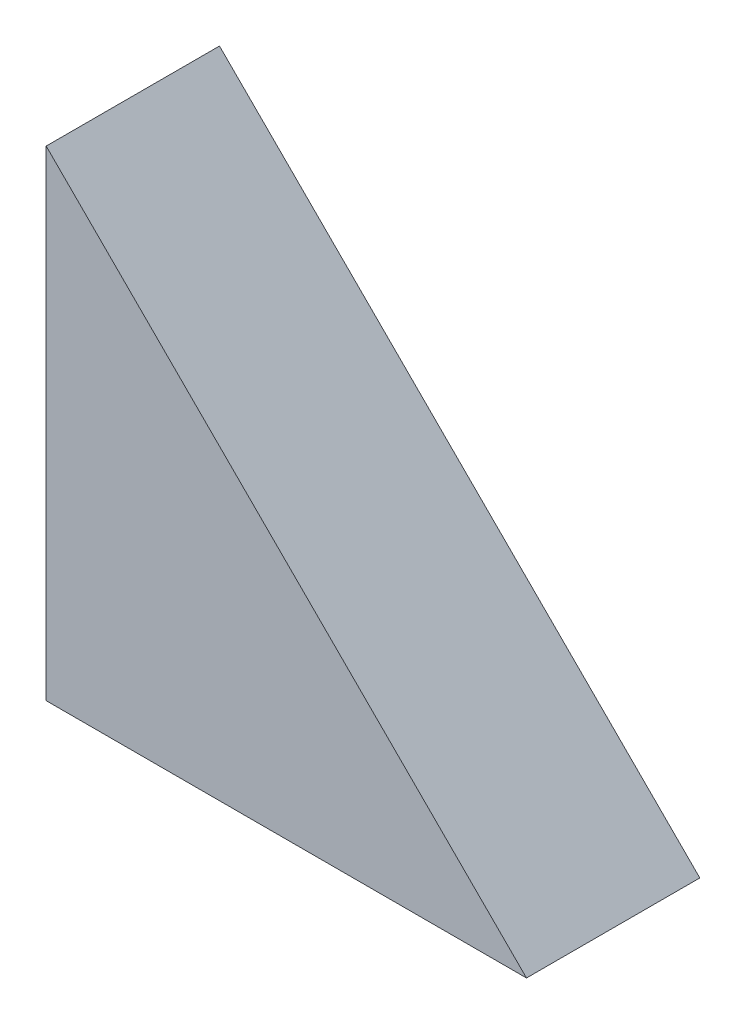
from build123d import *

# Parameters (mm, degrees)
BOSS_EXTRUDE1_DEPTH = 35


with BuildPart() as part:
    # Sketch3 → Boss-Extrude1 (new body)
    with BuildSketch(Plane.XY):
        Polygon((0, 0), (97, 0), (0, 97), align=None)
    extrude(amount=BOSS_EXTRUDE1_DEPTH)


solid = part.part
